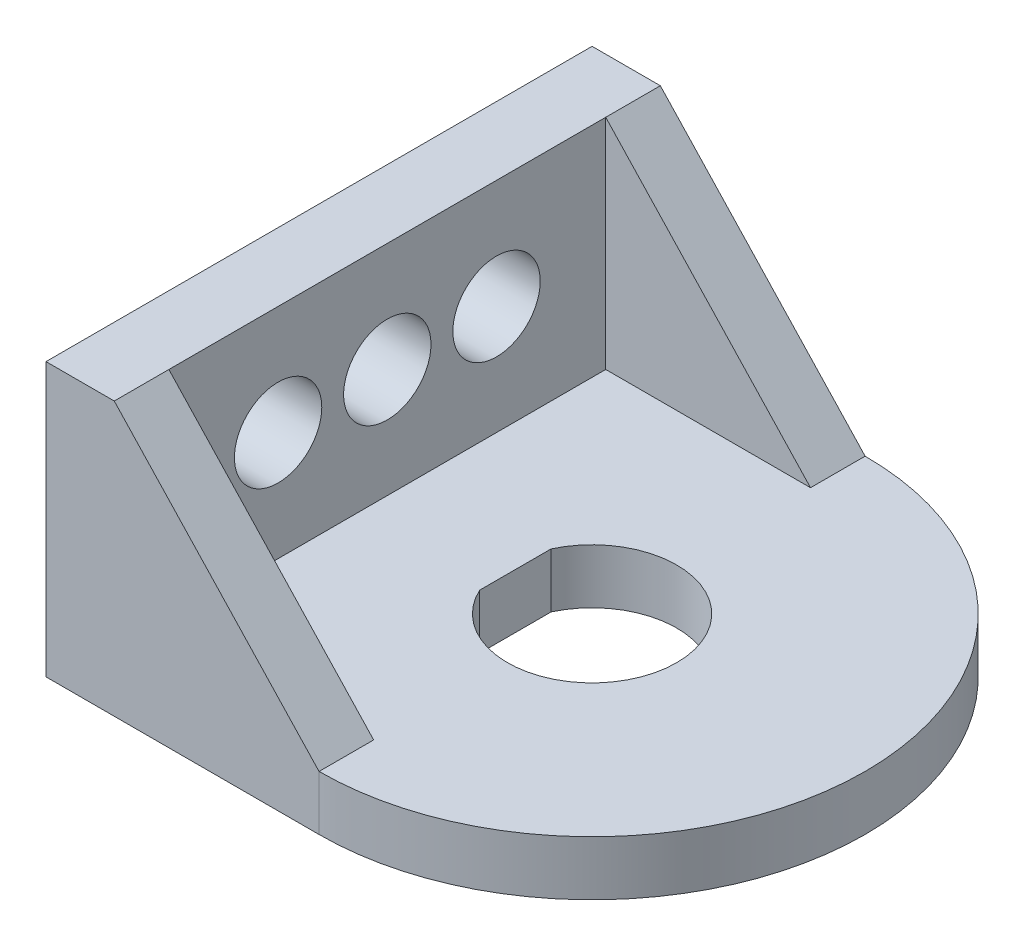
from build123d import *

# Parameters (mm, degrees)
SKETCH1_R           = 3.1
BOSS_EXTRUDE1_DEPTH = 2
BOSS_EXTRUDE2_DEPTH = 10
BOSS_EXTRUDE3_DEPTH = 2
BOSS_EXTRUDE4_DEPTH = 2
CUT_EXTRUDE1_DEPTH  = 5
BOSS_EXTRUDE5_START = -2
BOSS_EXTRUDE5_DEPTH = 2


with BuildPart() as part:
    # Sketch1 → Boss-Extrude1 (new body)
    with BuildSketch(Plane(origin=(0, 0, 0), x_dir=(1, 0, 0), z_dir=(0, 1, 0))):
        with BuildLine():
            ThreePointArc((0, -10), (10, 0), (0, 10))
            Line((0, 10), (-10, 10))
            Line((-10, 10), (-10, -10))
            Line((-10, -10), (0, -10))
        make_face()
        with Locations(Location((0, 0, 0), (0, 0, 270))):
            Circle(SKETCH1_R, mode=Mode.SUBTRACT)
    extrude(amount=BOSS_EXTRUDE1_DEPTH)

    # Sketch1<3> → Boss-Extrude2 (add)
    with BuildSketch(Plane(origin=(0, 0, 0), x_dir=(1, 0, 0), z_dir=(0, 1, 0))):
        with BuildLine():
            Line((-7.5, -6.614378278), (-7.5, 6.614378278))
            ThreePointArc((-7.5, 6.614378278), (-9.354143467, 3.535533906), (-10, 0))
            ThreePointArc((-10, 0), (-9.354143467, -3.535533906), (-7.5, -6.614378278))
        make_face()
        with BuildLine():
            Line((-7.5, 6.614378278), (-7.5, 10))
            Line((-7.5, 10), (-10, 10))
            Line((-10, 10), (-10, 0))
            ThreePointArc((-10, 0), (-9.354143467, 3.535533906), (-7.5, 6.614378278))
        make_face()
        with BuildLine():
            Line((-7.5, -10), (-7.5, -6.614378278))
            ThreePointArc((-7.5, -6.614378278), (-9.354143467, -3.535533906), (-10, 0))
            Line((-10, 0), (-10, -10))
            Line((-10, -10), (-7.5, -10))
        make_face()
    extrude(amount=BOSS_EXTRUDE2_DEPTH)

    # Sketch2 → Boss-Extrude3 (add)
    with BuildSketch(Plane.XY.offset(10)):
        Polygon((-7.5, 10), (0, 2), (-7.5, 2), align=None)
    extrude(amount=-BOSS_EXTRUDE3_DEPTH)

    # Sketch3 → Boss-Extrude4 (add)
    with BuildSketch(Plane(origin=(0, 0, -10), x_dir=(-1, 0, 0), z_dir=(0, 0, -1))):
        Polygon((0, 2), (7.5, 10), (7.5, 2), align=None)
    extrude(amount=-BOSS_EXTRUDE4_DEPTH)

    # Sketch4 → Cut-Extrude1 (cut)
    with BuildSketch(Plane(origin=(-7.5, 0, 0), x_dir=(0, 0, -1), z_dir=(1, 0, 0))):
        with BuildLine():
            ThreePointArc((-2.4, 6), (-4, 7.6), (-5.6, 6))
            Line((-5.6, 6), (-2.4, 6))
        make_face()
        with BuildLine():
            Line((-2.4, 6), (-5.6, 6))
            ThreePointArc((-5.6, 6), (-4, 4.4), (-2.4, 6))
        make_face()
        with BuildLine():
            ThreePointArc((1.6, 6), (0, 7.6), (-1.6, 6))
            Line((-1.6, 6), (0, 6))
            Line((0, 6), (1.6, 6))
        make_face()
        with BuildLine():
            Line((0, 6), (-1.6, 6))
            ThreePointArc((-1.6, 6), (0, 4.4), (1.6, 6))
            Line((1.6, 6), (0, 6))
        make_face()
        with BuildLine():
            ThreePointArc((5.6, 6), (4, 7.6), (2.4, 6))
            Line((2.4, 6), (5.6, 6))
        make_face()
        with BuildLine():
            Line((5.6, 6), (2.4, 6))
            ThreePointArc((2.4, 6), (4, 4.4), (5.6, 6))
        make_face()
    extrude(amount=-CUT_EXTRUDE1_DEPTH, mode=Mode.SUBTRACT)

    # Sketch5 → Boss-Extrude5 (add)
    with BuildSketch(Plane(origin=(0, 2, 0), x_dir=(1, 0, 0), z_dir=(0, 1, 0)).offset(BOSS_EXTRUDE5_START)):
        with BuildLine():
            Line((-2.81, -1.309160036), (-2.81, 0))
            Line((-2.81, 0), (-2.81, 1.309160036))
            ThreePointArc((-2.81, 1.309160036), (-3.1, 0), (-2.81, -1.309160036))
        make_face()
    extrude(amount=BOSS_EXTRUDE5_DEPTH)


solid = part.part
